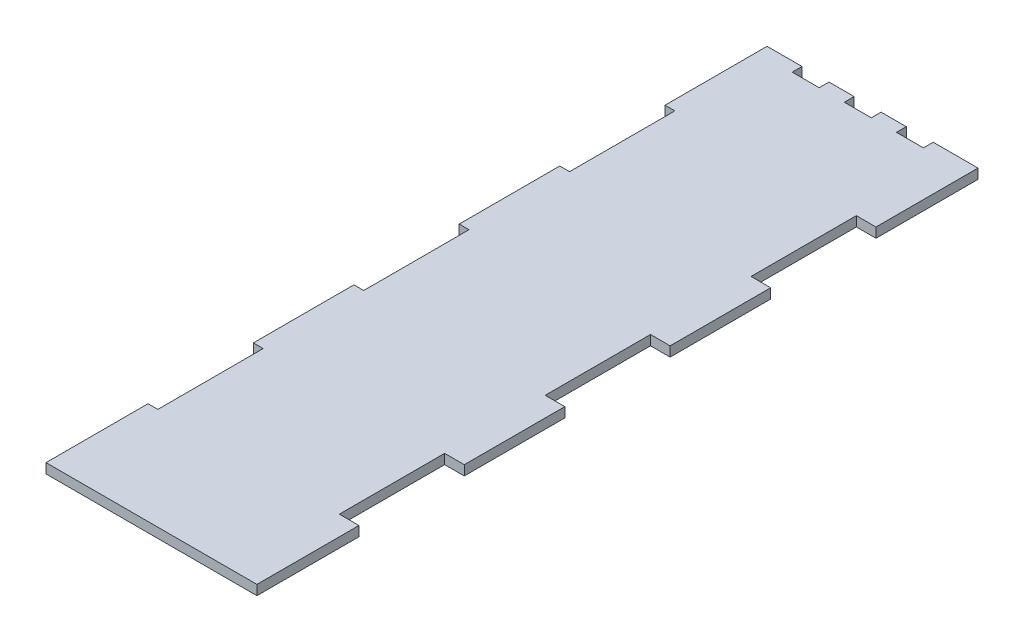
from build123d import *

# Parameters (mm, degrees)
SKETCH_4_W      = 37
SKETCH_4_H      = 145
EXTRUDE_1_DEPTH = 2
SKETCH_5_W      = 5.125
SKETCH_5_H      = 2
EXTRUDE_2_DEPTH = 2
SKETCH_7_W      = 20.8
SKETCH_7_H      = 2
SKETCH_7_W_2    = 20.5
EXTRUDE_3_DEPTH = 4
EXTRUDE_START   = -37
SKETCH_7_2_W    = 20.8
SKETCH_7_2_H    = 2
SKETCH_7_2_W_2  = 20.5
EXTRUDE_4_DEPTH = 2
EXTRUDE_START_2 = -2.2
EXTRUDE_5_DEPTH = 142.8


with BuildPart() as part:
    # 草图4 → 凸台-拉伸1 (new body)
    with BuildSketch(Plane(origin=(0, 0, 0), x_dir=(1, 0, 0), z_dir=(0, 1, 0))):
        Rectangle(SKETCH_4_W, SKETCH_4_H)
    extrude(amount=EXTRUDE_1_DEPTH)

    # 草图5 → 凸台-拉伸2 (add)
    with BuildSketch(Plane(origin=(0, 0, -72.5), x_dir=(-1, 0, 0), z_dir=(0, 0, -1))):
        with Locations((-15.9375, 1)):
            Rectangle(SKETCH_5_W, SKETCH_5_H)
        with Locations((-5.3125, 1)):
            Rectangle(SKETCH_5_W, SKETCH_5_H)
        with Locations((5.3125, 1)):
            Rectangle(SKETCH_5_W, SKETCH_5_H)
        with Locations((15.9375, 1)):
            Rectangle(SKETCH_5_W, SKETCH_5_H)
    extrude(amount=EXTRUDE_2_DEPTH)

    # 草图7 → 凸台-拉伸3 (add)
    with BuildSketch(Plane(origin=(18.5, 0, 0), x_dir=(0, 0, -1), z_dir=(1, 0, 0))):
        with Locations((-62.1, 1)):
            Rectangle(SKETCH_7_W, SKETCH_7_H)
        with Locations((-19.983333333, 1)):
            Rectangle(SKETCH_7_W_2, SKETCH_7_H)
        with Locations((21.983333333, 1)):
            Rectangle(SKETCH_7_W_2, SKETCH_7_H)
        with Locations((64.1, 1)):
            Rectangle(SKETCH_7_W, SKETCH_7_H)
    extrude(amount=EXTRUDE_3_DEPTH)

    # 草图7<2> → 凸台-拉伸4 (add)
    with BuildSketch(Plane(origin=(18.5, 0, 0), x_dir=(0, 0, -1), z_dir=(1, 0, 0)).offset(EXTRUDE_START)):
        with Locations((-62.1, 1)):
            Rectangle(SKETCH_7_2_W, SKETCH_7_2_H)
        with Locations((-19.983333333, 1)):
            Rectangle(SKETCH_7_2_W_2, SKETCH_7_2_H)
        with Locations((21.983333333, 1)):
            Rectangle(SKETCH_7_2_W_2, SKETCH_7_2_H)
        with Locations((64.1, 1)):
            Rectangle(SKETCH_7_2_W, SKETCH_7_2_H)
    extrude(amount=-EXTRUDE_4_DEPTH)

    # 草图9 → 凸台-拉伸5 (add)
    with BuildSketch(Plane.XY.offset(72.5).offset(EXTRUDE_START_2)):
        Polygon((-9.8, 0), (-11.6, -1.8), (-9.8, -1.8), (9.8, -1.8), (11.6, -1.8), (9.8, 0), align=None)
    extrude(amount=-EXTRUDE_5_DEPTH)


solid = part.part
